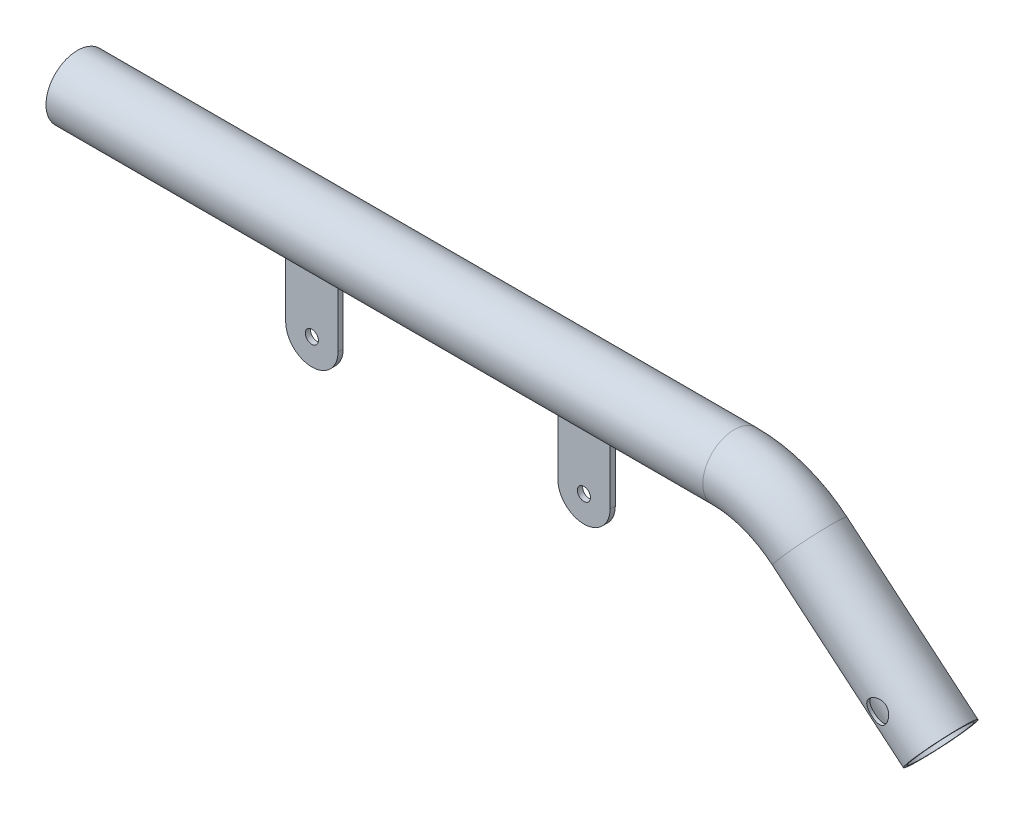
from build123d import *

# Parameters (mm, degrees)
SKETCH2_R                = 12
SKETCH2_R_2              = 10.8
CUT_EXTRUDE1_DEPTH       = 20
CUT_EXTRUDE1_DEPTH_BACK  = 20
SKETCH3_R                = 4.14257131
BOSS_EXTRUDE1_DEPTH      = 1
BOSS_EXTRUDE1_DEPTH_BACK = 1
SKETCH4_R                = 2.5


with BuildPart() as part:
    # Sweep1: sweep along a path in Sketch1
    with BuildLine(Plane.XY) as sweep1_path:
        Line((-209.367896725, 0), (41.706660839, 0))
        ThreePointArc((41.706660839, 0), (57.097567289, -2.713832065), (70.632103275, -10.52800006))
        Line((70.632103275, -10.52800006), (120.632103275, -52.482981619))
    # Sketch2 → Sweep1 (sweep)
    with BuildSketch(Plane(origin=(-209.367896725, 0, 0), x_dir=(0, 0, -1), z_dir=(1, 0, 0))):
        Circle(SKETCH2_R)
        Circle(SKETCH2_R_2, mode=Mode.SUBTRACT)
    sweep(path=sweep1_path.line)

    # Sketch3 → Cut-Extrude1 (cut, two sides: drawn at the far end of the back side and taken through both)
    with BuildSketch(Plane.XY.offset(-CUT_EXTRUDE1_DEPTH_BACK)):
        with Locations((108.258660408, -42.100430272)):
            Circle(SKETCH3_R)
    extrude(amount=CUT_EXTRUDE1_DEPTH + CUT_EXTRUDE1_DEPTH_BACK, mode=Mode.SUBTRACT)

    # Sketch4 → Boss-Extrude1 (add, two sides: drawn at the far end of the back side and taken through both)
    # profile 1 of 2: a face of its own
    with BuildSketch(Plane.XY.offset(-BOSS_EXTRUDE1_DEPTH_BACK)):
        with BuildLine():
            Line((-128.741339592, 0), (-128.741339592, -37))
            ThreePointArc((-128.741339592, -37), (-118.741339592, -47), (-108.741339592, -37))
            Line((-108.741339592, -37), (-108.741339592, 0))
            Line((-108.741339592, 0), (-128.741339592, 0))
        make_face()
        with Locations((-118.741339592, -37)):
            Circle(SKETCH4_R, mode=Mode.SUBTRACT)
    # profile 2 of 2: a face of its own
    with BuildSketch(Plane.XY.offset(-BOSS_EXTRUDE1_DEPTH_BACK)):
        with BuildLine():
            Line((-24.741339592, 0), (-4.741339592, 0))
            Line((-4.741339592, 0), (-4.741339592, -37))
            ThreePointArc((-4.741339592, -37), (-14.741339592, -47), (-24.741339592, -37))
            Line((-24.741339592, -37), (-24.741339592, 0))
        make_face()
        with Locations((-14.741339592, -37)):
            Circle(SKETCH4_R, mode=Mode.SUBTRACT)
    extrude(amount=BOSS_EXTRUDE1_DEPTH + BOSS_EXTRUDE1_DEPTH_BACK)


solid = part.part
